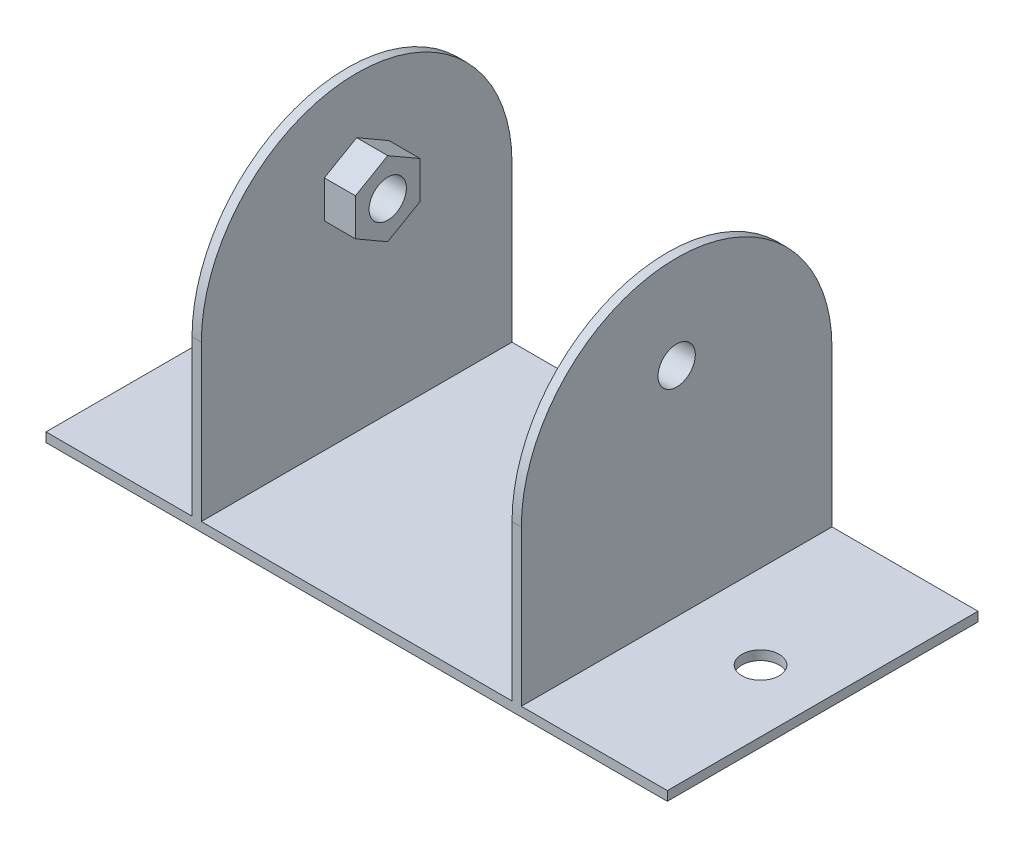
from build123d import *

# Parameters (mm, degrees)
BOSS_EXTRUDE1_DEPTH = 50
CUT_EXTRUDE1_REACH  = 88.603
SKETCH2_R           = 3
SKETCH3_R           = 3
CUT_EXTRUDE2_DEPTH  = 70
FILLET2_RADIUS      = 25
FILLET2_LENGTH      = 1.5
FILLET3_RADIUS      = 25
FILLET3_LENGTH      = 1.5
SKETCH4_R           = 3
BOSS_EXTRUDE2_DEPTH = 5


with BuildPart() as part:
    # Sketch1 → Boss-Extrude1 (new body)
    with BuildSketch(Plane.XY):
        Polygon((50, -1.5), (-50, -1.5), (-50, 0), (-26.5, 0), (-26.5, 50), (-25, 50), (-25, 0), (25, 0), (25, 50), (26.5, 50), (26.5, 0), (50, 0), align=None)
    extrude(amount=BOSS_EXTRUDE1_DEPTH)

    # Sketch2 → Cut-Extrude1 (cut, up to next)
    with BuildSketch(Plane(origin=(0, 0, 0), x_dir=(1, 0, 0), z_dir=(0, 1, 0)), mode=Mode.PRIVATE) as cut_extrude1_sk1:
        with Locations(Location((-40, -25, 0), (0, 0, 270))):
            Circle(SKETCH2_R)
    cut_extrude1_tool1 = extrude(cut_extrude1_sk1.sketch, amount=-CUT_EXTRUDE1_REACH, mode=Mode.PRIVATE) & part.part
    # Sketch2 → Cut-Extrude1 (cut, up to next)
    with BuildSketch(Plane(origin=(0, 0, 0), x_dir=(1, 0, 0), z_dir=(0, 1, 0)), mode=Mode.PRIVATE) as cut_extrude1_sk2:
        with Locations(Location((40, -25, 0), (0, 0, 270))):
            Circle(SKETCH2_R)
    cut_extrude1_tool2 = extrude(cut_extrude1_sk2.sketch, amount=-CUT_EXTRUDE1_REACH, mode=Mode.PRIVATE) & part.part
    add(cut_extrude1_tool1.solids().sort_by_distance((-40, 0, 25))[0], mode=Mode.SUBTRACT)
    add(cut_extrude1_tool2.solids().sort_by_distance((40, 0, 25))[0], mode=Mode.SUBTRACT)

    # Sketch3 → Cut-Extrude2 (cut)
    with BuildSketch(Plane.ZY.offset(26.5)):
        with Locations(Location((25, 35, 0), (0, 0, 270))):
            Circle(SKETCH3_R)
    extrude(amount=-CUT_EXTRUDE2_DEPTH, mode=Mode.SUBTRACT)

    # Fillet2: full round fillet: the end face becomes a half cylinder, R = half its width
    fillet2_face = Plane((25.75, 50, 25), x_dir=(1, 0, 0), z_dir=(0, 1, 0))  # on the end face: x along it, z out of the body
    fillet2_slab = fillet2_face.offset(-FILLET2_RADIUS / 2) * Box(FILLET2_LENGTH, 2 * FILLET2_RADIUS, FILLET2_RADIUS, mode=Mode.PRIVATE)  # the body's end, R deep
    fillet2_round = Plane((25.75, 25, 25), x_dir=(0, 1, 0), z_dir=(1, 0, 0)) * Cylinder(FILLET2_RADIUS, FILLET2_LENGTH, mode=Mode.PRIVATE)  # its axis R under the face
    add(fillet2_slab - fillet2_round, mode=Mode.SUBTRACT)

    # Fillet3: full round fillet: the end face becomes a half cylinder, R = half its width
    fillet3_face = Plane((-25.75, 50, 25), x_dir=(-1, 0, 0), z_dir=(0, 1, 0))  # on the end face: x along it, z out of the body
    fillet3_slab = fillet3_face.offset(-FILLET3_RADIUS / 2) * Box(FILLET3_LENGTH, 2 * FILLET3_RADIUS, FILLET3_RADIUS, mode=Mode.PRIVATE)  # the body's end, R deep
    fillet3_round = Plane((-25.75, 25, 25), x_dir=(0, 1, 0), z_dir=(-1, 0, 0)) * Cylinder(FILLET3_RADIUS, FILLET3_LENGTH, mode=Mode.PRIVATE)  # its axis R under the face
    add(fillet3_slab - fillet3_round, mode=Mode.SUBTRACT)

    # Sketch4 → Boss-Extrude2 (add)
    with BuildSketch(Plane(origin=(-25, 0, 0), x_dir=(0, 0, -1), z_dir=(1, 0, 0))):
        Polygon((-30.196152423, 32), (-25, 29), (-19.803847577, 32), (-19.803847577, 38), (-25, 41), (-30.196152423, 38), align=None)
        with Locations(Location((-25, 35, 0), (0, 0, 270))):
            Circle(SKETCH4_R, mode=Mode.SUBTRACT)
    boss_extrude2 = extrude(amount=BOSS_EXTRUDE2_DEPTH)

    # Mirror1: Boss-Extrude2 across plane
    add(boss_extrude2.mirror(Plane(origin=(0, 0, 0), x_dir=(0, 0, 1), z_dir=(1, 0, 0))))


solid = part.part
